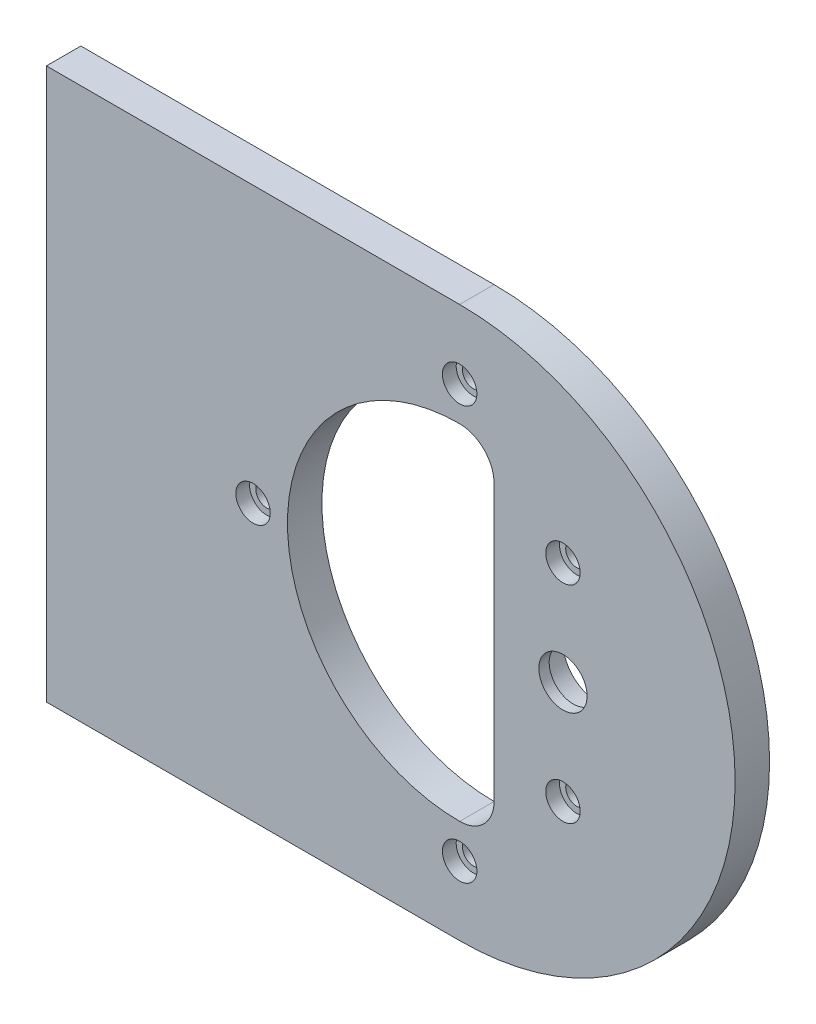
from build123d import *

# Parameters (mm, degrees)
EXTRUDE_1_DEPTH      = 5
CUT_EXTRUDE_2_DEPTH  = 10
SKETCH_4_R           = 5
CUT_EXTRUDE_3_DEPTH  = 3.5
SKETCH_8_R           = 1
CUT_EXTRUDE_7_DEPTH  = 1
SKETCH_10_R          = 2.5
CUT_EXTRUDE_8_DEPTH  = 2
SKETCH_9_R           = 1.6
CUT_EXTRUDE_9_DEPTH  = 3
SKETCH_11_R          = 3.5
CUT_EXTRUDE_10_DEPTH = 10


with BuildPart() as part:
    # 草图1 → 凸台-拉伸1 (new body)
    with BuildSketch(Plane.XY):
        with BuildLine():
            Line((66.457513111, 70), (6.457513111, 70))
            Line((6.457513111, 70), (6.457513111, -10))
            Line((6.457513111, -10), (66.457513111, -10))
            ThreePointArc((66.457513111, -10), (106.457513111, 30), (66.457513111, 70))
        make_face()
    extrude(amount=EXTRUDE_1_DEPTH)

    # 草图3 → 切除-拉伸2 (cut)
    with BuildSketch(Plane.XY):
        with BuildLine():
            Line((71.457513111, 35), (71.457513111, 50))
            ThreePointArc((71.457513111, 50), (69.993047017, 53.535533906), (66.457513111, 55))
            ThreePointArc((66.457513111, 55), (41.457513111, 30), (66.457513111, 5))
            ThreePointArc((66.457513111, 5), (69.993047017, 6.464466094), (71.457513111, 10))
            Line((71.457513111, 10), (71.457513111, 35))
        make_face()
    extrude(amount=CUT_EXTRUDE_2_DEPTH, mode=Mode.SUBTRACT)

    # 草图4 → 切除-拉伸3 (cut)
    with BuildSketch(Plane.XY):
        with Locations((81.457513111, 30)):
            Circle(SKETCH_4_R)
    extrude(amount=CUT_EXTRUDE_3_DEPTH, mode=Mode.SUBTRACT)

    # 草图8 → 切除-拉伸7 (cut)
    with BuildSketch(Plane.XY):
        with Locations((66.457513111, 67.5)):
            Circle(SKETCH_8_R)
        with Locations((92.974017405, 56.516504294)):
            Circle(SKETCH_8_R)
        with Locations((103.957513111, 30)):
            Circle(SKETCH_8_R)
        with Locations((92.974017405, 3.483495706)):
            Circle(SKETCH_8_R)
        with Locations((66.457513111, -7.5)):
            Circle(SKETCH_8_R)
        with Locations((39.941008816, 3.483495706)):
            Circle(SKETCH_8_R)
        with Locations((28.957513111, 30)):
            Circle(SKETCH_8_R)
        with Locations((39.941008816, 56.516504294)):
            Circle(SKETCH_8_R)
    extrude(amount=CUT_EXTRUDE_7_DEPTH, mode=Mode.SUBTRACT)

    # 草图10 → 切除-拉伸8 (cut)
    with BuildSketch(Plane.XY.offset(5)):
        with Locations((66.457513111, 60)):
            Circle(SKETCH_10_R)
        with Locations((81.457513111, 45)):
            Circle(SKETCH_10_R)
        with Locations((66.457513111, 0)):
            Circle(SKETCH_10_R)
        with Locations((36.457513111, 30)):
            Circle(SKETCH_10_R)
        with Locations((81.457513111, 15)):
            Circle(SKETCH_10_R)
    extrude(amount=-CUT_EXTRUDE_8_DEPTH, mode=Mode.SUBTRACT)

    # 草图9 → 切除-拉伸9 (cut)
    with BuildSketch(Plane.XY):
        with Locations((81.457513111, 45)):
            Circle(SKETCH_9_R)
        with Locations((66.457513111, 60)):
            Circle(SKETCH_9_R)
        with Locations((81.457513111, 15)):
            Circle(SKETCH_9_R)
        with Locations((66.457513111, 0)):
            Circle(SKETCH_9_R)
        with Locations((36.457513111, 30)):
            Circle(SKETCH_9_R)
    extrude(amount=CUT_EXTRUDE_9_DEPTH, mode=Mode.SUBTRACT)

    # 草图11 → 切除-拉伸10 (cut)
    with BuildSketch(Plane.XY.offset(5)):
        with Locations((81.457513111, 30)):
            Circle(SKETCH_11_R)
    extrude(amount=-CUT_EXTRUDE_10_DEPTH, mode=Mode.SUBTRACT)


solid = part.part
